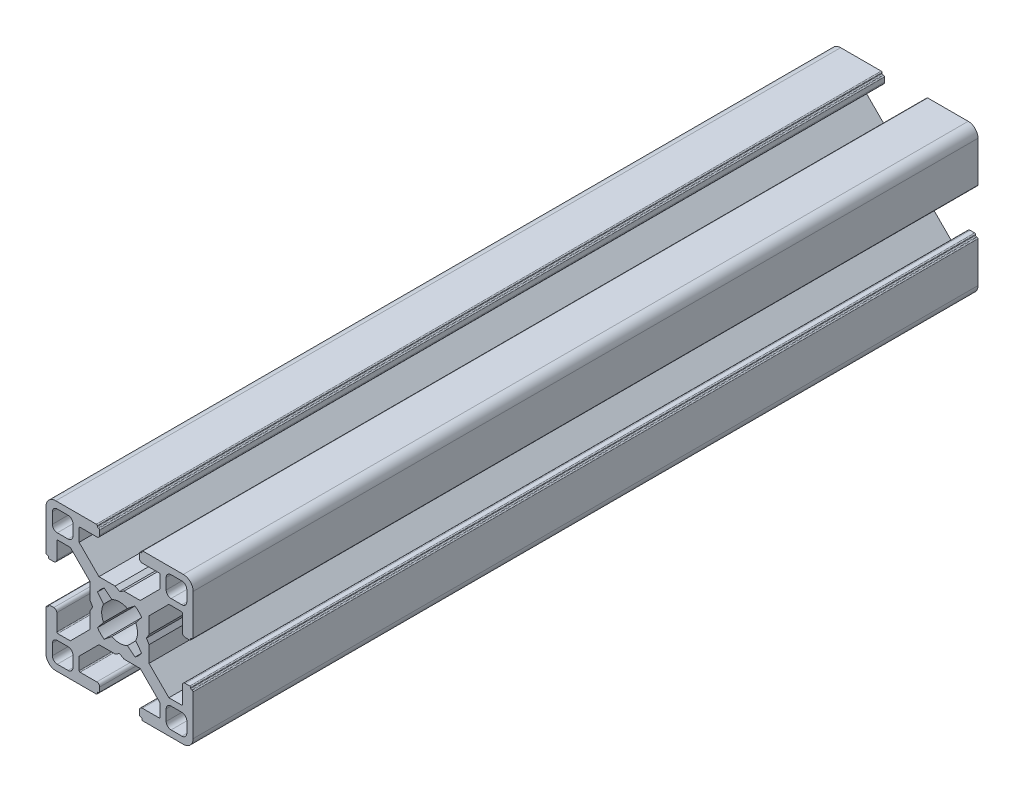
from build123d import *

# Parameters (mm, degrees)
BASE_EXTRUDE_DEPTH = 160


with BuildPart() as part:
    # Sketch1 → Base-Extrude (new body)
    with BuildSketch(Plane.XY):
        with BuildLine():
            Line((6.00446543, 0.899999619), (5.484852164, 0))
            Line((5.484852164, 0), (6.00446543, -0.899999619))
            Line((6.00446543, -0.899999619), (6.00446543, -4.204465866))
            Line((6.00446543, -4.204465866), (10.049999564, -8.25))
            Line((10.049999564, -8.25), (12.59999928, -8.25))
            ThreePointArc((12.59999928, -8.25), (12.741420837, -8.191421273), (12.799999564, -8.049999716))
            Line((12.799999564, -8.049999716), (12.799999564, -4.649999613))
            ThreePointArc((12.799999564, -4.649999613), (12.975735606, -4.225735278), (13.39999994, -4.049999237))
            Line((13.39999994, -4.049999237), (14.300000043, -4.049999237))
            ThreePointArc((14.300000043, -4.049999237), (14.4414216, -4.108577964), (14.500000327, -4.249999521))
            Line((14.500000327, -4.249999521), (14.500000327, -4.349998953))
            ThreePointArc((14.500000327, -4.349998953), (14.558579054, -4.49142051), (14.700000611, -4.549999237))
            Line((14.700000611, -4.549999237), (14.799999716, -4.549999237))
            ThreePointArc((14.799999716, -4.549999237), (14.941421273, -4.608577964), (15, -4.749999521))
            Line((15, -4.749999521), (15, -13.000000346))
            ThreePointArc((15, -13.000000346), (14.414213664, -14.414213664), (13.000000346, -15))
            Line((13.000000346, -15), (4.749999945, -15))
            ThreePointArc((4.749999945, -15), (4.60857832, -14.941421245), (4.549999564, -14.799999619))
            Line((4.549999564, -14.799999619), (4.549999564, -14.69999942))
            ThreePointArc((4.549999564, -14.69999942), (4.49142109, -14.558578474), (4.350000144, -14.5))
            Line((4.350000144, -14.5), (4.250000374, -14.5))
            ThreePointArc((4.250000374, -14.5), (4.108578753, -14.441421247), (4.05, -14.299999626))
            Line((4.05, -14.299999626), (4.05, -13.399999434))
            ThreePointArc((4.05, -13.399999434), (4.225735989, -12.975735226), (4.650000197, -12.799999237))
            Line((4.650000197, -12.799999237), (8.049999924, -12.799999237))
            ThreePointArc((8.049999924, -12.799999237), (8.191421565, -12.741420475), (8.250000327, -12.599998834))
            Line((8.250000327, -12.599998834), (8.250000327, -10.049999237))
            Line((8.250000327, -10.049999237), (4.204466193, -6))
            Line((4.204466193, -6), (0.899999946, -6))
            Line((0.899999946, -6), (0, -5.484851837))
            Line((0, -5.484851837), (-0.899999946, -6))
            Line((-0.899999946, -6), (-4.204466193, -6))
            Line((-4.204466193, -6), (-8.250000327, -10.049999237))
            Line((-8.250000327, -10.049999237), (-8.250000327, -12.599998834))
            ThreePointArc((-8.250000327, -12.599998834), (-8.191421565, -12.741420475), (-8.049999924, -12.799999237))
            Line((-8.049999924, -12.799999237), (-4.650000197, -12.799999237))
            ThreePointArc((-4.650000197, -12.799999237), (-4.225735989, -12.975735226), (-4.05, -13.399999434))
            Line((-4.05, -13.399999434), (-4.05, -14.299999626))
            ThreePointArc((-4.05, -14.299999626), (-4.108578753, -14.441421247), (-4.250000374, -14.5))
            Line((-4.250000374, -14.5), (-4.350000144, -14.5))
            ThreePointArc((-4.350000144, -14.5), (-4.49142109, -14.558578474), (-4.549999564, -14.69999942))
            Line((-4.549999564, -14.69999942), (-4.549999564, -14.799999619))
            ThreePointArc((-4.549999564, -14.799999619), (-4.60857832, -14.941421245), (-4.749999945, -15))
            Line((-4.749999945, -15), (-13.000000346, -15))
            ThreePointArc((-13.000000346, -15), (-14.414213664, -14.414213664), (-15, -13.000000346))
            Line((-15, -13.000000346), (-15, -4.749999521))
            ThreePointArc((-15, -4.749999521), (-14.941421273, -4.608577964), (-14.799999716, -4.549999237))
            Line((-14.799999716, -4.549999237), (-14.700000611, -4.549999237))
            ThreePointArc((-14.700000611, -4.549999237), (-14.558579054, -4.49142051), (-14.500000327, -4.349998953))
            Line((-14.500000327, -4.349998953), (-14.500000327, -4.249999521))
            ThreePointArc((-14.500000327, -4.249999521), (-14.4414216, -4.108577964), (-14.300000043, -4.049999237))
            Line((-14.300000043, -4.049999237), (-13.39999994, -4.049999237))
            ThreePointArc((-13.39999994, -4.049999237), (-12.975735606, -4.225735278), (-12.799999564, -4.649999613))
            Line((-12.799999564, -4.649999613), (-12.799999564, -8.049999716))
            ThreePointArc((-12.799999564, -8.049999716), (-12.741420837, -8.191421273), (-12.59999928, -8.25))
            Line((-12.59999928, -8.25), (-10.049999564, -8.25))
            Line((-10.049999564, -8.25), (-6.00446543, -4.204465866))
            Line((-6.00446543, -4.204465866), (-6.00446543, -0.899999619))
            Line((-6.00446543, -0.899999619), (-5.484852164, 0))
            Line((-5.484852164, 0), (-6.00446543, 0.899999619))
            Line((-6.00446543, 0.899999619), (-6.00446543, 4.204465866))
            Line((-6.00446543, 4.204465866), (-10.049999564, 8.25))
            Line((-10.049999564, 8.25), (-12.59999928, 8.25))
            ThreePointArc((-12.59999928, 8.25), (-12.741420837, 8.191421273), (-12.799999564, 8.049999716))
            Line((-12.799999564, 8.049999716), (-12.799999564, 4.649999613))
            ThreePointArc((-12.799999564, 4.649999613), (-12.975735606, 4.225735278), (-13.39999994, 4.049999237))
            Line((-13.39999994, 4.049999237), (-14.300000043, 4.049999237))
            ThreePointArc((-14.300000043, 4.049999237), (-14.4414216, 4.108577964), (-14.500000327, 4.249999521))
            Line((-14.500000327, 4.249999521), (-14.500000327, 4.349998953))
            ThreePointArc((-14.500000327, 4.349998953), (-14.558579054, 4.49142051), (-14.700000611, 4.549999237))
            Line((-14.700000611, 4.549999237), (-14.799999716, 4.549999237))
            ThreePointArc((-14.799999716, 4.549999237), (-14.941421273, 4.608577964), (-15, 4.749999521))
            Line((-15, 4.749999521), (-15, 13.000000346))
            ThreePointArc((-15, 13.000000346), (-14.414213664, 14.414213664), (-13.000000346, 15))
            Line((-13.000000346, 15), (-4.749999945, 15))
            ThreePointArc((-4.749999945, 15), (-4.60857832, 14.941421245), (-4.549999564, 14.799999619))
            Line((-4.549999564, 14.799999619), (-4.549999564, 14.69999942))
            ThreePointArc((-4.549999564, 14.69999942), (-4.49142109, 14.558578474), (-4.350000144, 14.5))
            Line((-4.350000144, 14.5), (-4.250000374, 14.5))
            ThreePointArc((-4.250000374, 14.5), (-4.108578753, 14.441421247), (-4.05, 14.299999626))
            Line((-4.05, 14.299999626), (-4.05, 13.399999434))
            ThreePointArc((-4.05, 13.399999434), (-4.225735989, 12.975735226), (-4.650000197, 12.799999237))
            Line((-4.650000197, 12.799999237), (-8.049999924, 12.799999237))
            ThreePointArc((-8.049999924, 12.799999237), (-8.191421565, 12.741420475), (-8.250000327, 12.599998834))
            Line((-8.250000327, 12.599998834), (-8.250000327, 10.049999237))
            Line((-8.250000327, 10.049999237), (-4.204466193, 6))
            Line((-4.204466193, 6), (-0.899999946, 6))
            Line((-0.899999946, 6), (0, 5.484851837))
            Line((0, 5.484851837), (0.899999946, 6))
            Line((0.899999946, 6), (4.204466193, 6))
            Line((4.204466193, 6), (8.250000327, 10.049999237))
            Line((8.250000327, 10.049999237), (8.250000327, 12.599998834))
            ThreePointArc((8.250000327, 12.599998834), (8.191421565, 12.741420475), (8.049999924, 12.799999237))
            Line((8.049999924, 12.799999237), (4.650000197, 12.799999237))
            ThreePointArc((4.650000197, 12.799999237), (4.225735989, 12.975735226), (4.05, 13.399999434))
            Line((4.05, 13.399999434), (4.05, 14.299999626))
            ThreePointArc((4.05, 14.299999626), (4.108578753, 14.441421247), (4.250000374, 14.5))
            Line((4.250000374, 14.5), (4.350000144, 14.5))
            ThreePointArc((4.350000144, 14.5), (4.49142109, 14.558578474), (4.549999564, 14.69999942))
            Line((4.549999564, 14.69999942), (4.549999564, 14.799999619))
            ThreePointArc((4.549999564, 14.799999619), (4.60857832, 14.941421245), (4.749999945, 15))
            Line((4.749999945, 15), (13.000000346, 15))
            ThreePointArc((13.000000346, 15), (14.414213664, 14.414213664), (15, 13.000000346))
            Line((15, 13.000000346), (15, 4.749999521))
            ThreePointArc((15, 4.749999521), (14.941421273, 4.608577964), (14.799999716, 4.549999237))
            Line((14.799999716, 4.549999237), (14.700000611, 4.549999237))
            ThreePointArc((14.700000611, 4.549999237), (14.558579054, 4.49142051), (14.500000327, 4.349998953))
            Line((14.500000327, 4.349998953), (14.500000327, 4.249999521))
            ThreePointArc((14.500000327, 4.249999521), (14.4414216, 4.108577964), (14.300000043, 4.049999237))
            Line((14.300000043, 4.049999237), (13.39999994, 4.049999237))
            ThreePointArc((13.39999994, 4.049999237), (12.975735606, 4.225735278), (12.799999564, 4.649999613))
            Line((12.799999564, 4.649999613), (12.799999564, 8.049999716))
            ThreePointArc((12.799999564, 8.049999716), (12.741420837, 8.191421273), (12.59999928, 8.25))
            Line((12.59999928, 8.25), (10.049999564, 8.25))
            Line((10.049999564, 8.25), (6.00446543, 4.204465866))
            Line((6.00446543, 4.204465866), (6.00446543, 0.899999619))
        make_face()
        with BuildLine():
            Line((13.70000109, 12.700000408), (13.70000109, 10.499999626))
            ThreePointArc((13.70000109, 10.499999626), (13.407107874, 9.792892851), (12.7000011, 9.499999635))
            Line((12.7000011, 9.499999635), (10.500000318, 9.499999635))
            ThreePointArc((10.500000318, 9.499999635), (9.792893543, 9.792892851), (9.500000327, 10.499999626))
            Line((9.500000327, 10.499999626), (9.500000327, 12.700000408))
            ThreePointArc((9.500000327, 12.700000408), (9.792893543, 13.407107182), (10.500000318, 13.700000398))
            Line((10.500000318, 13.700000398), (12.7000011, 13.700000398))
            ThreePointArc((12.7000011, 13.700000398), (13.407107874, 13.407107182), (13.70000109, 12.700000408))
        make_face(mode=Mode.SUBTRACT)
        with BuildLine():
            Line((3.135929412, 4.518400903), (1.600129524, 3.280561767))
            ThreePointArc((1.600129524, 3.280561767), (0, 3.65), (-1.600129524, 3.280561767))
            Line((-1.600129524, 3.280561767), (-3.135929412, 4.518400903))
            ThreePointArc((-3.135929412, 4.518400903), (-3.881002259, 3.897155561), (-4.505336892, 3.154669473))
            Line((-4.505336892, 3.154669473), (-3.280561732, 1.600129597))
            ThreePointArc((-3.280561732, 1.600129597), (-3.65, 0), (-3.280561732, -1.600129597))
            Line((-3.280561732, -1.600129597), (-4.505336892, -3.154669473))
            ThreePointArc((-4.505336892, -3.154669473), (-3.881002259, -3.897155561), (-3.135929412, -4.518400903))
            Line((-3.135929412, -4.518400903), (-1.600129524, -3.280561767))
            ThreePointArc((-1.600129524, -3.280561767), (0, -3.65), (1.600129524, -3.280561767))
            Line((1.600129524, -3.280561767), (3.135929412, -4.518400903))
            ThreePointArc((3.135929412, -4.518400903), (3.881002259, -3.897155561), (4.505336892, -3.154669473))
            Line((4.505336892, -3.154669473), (3.280561732, -1.600129597))
            ThreePointArc((3.280561732, -1.600129597), (3.65, 0), (3.280561732, 1.600129597))
            Line((3.280561732, 1.600129597), (4.505336892, 3.154669473))
            ThreePointArc((4.505336892, 3.154669473), (3.881002259, 3.897155561), (3.135929412, 4.518400903))
        make_face(mode=Mode.SUBTRACT)
        with BuildLine():
            Line((-13.70000109, -12.700000408), (-13.70000109, -10.499999626))
            ThreePointArc((-13.70000109, -10.499999626), (-13.407107874, -9.792892851), (-12.7000011, -9.499999635))
            Line((-12.7000011, -9.499999635), (-10.500000318, -9.499999635))
            ThreePointArc((-10.500000318, -9.499999635), (-9.792893543, -9.792892851), (-9.500000327, -10.499999626))
            Line((-9.500000327, -10.499999626), (-9.500000327, -12.700000408))
            ThreePointArc((-9.500000327, -12.700000408), (-9.792893543, -13.407107182), (-10.500000318, -13.700000398))
            Line((-10.500000318, -13.700000398), (-12.7000011, -13.700000398))
            ThreePointArc((-12.7000011, -13.700000398), (-13.407107874, -13.407107182), (-13.70000109, -12.700000408))
        make_face(mode=Mode.SUBTRACT)
        with BuildLine():
            Line((10.500000318, -13.700000398), (12.7000011, -13.700000398))
            ThreePointArc((12.7000011, -13.700000398), (13.407107874, -13.407107182), (13.70000109, -12.700000408))
            Line((13.70000109, -12.700000408), (13.70000109, -10.499999626))
            ThreePointArc((13.70000109, -10.499999626), (13.407107874, -9.792892851), (12.7000011, -9.499999635))
            Line((12.7000011, -9.499999635), (10.500000318, -9.499999635))
            ThreePointArc((10.500000318, -9.499999635), (9.792893543, -9.792892851), (9.500000327, -10.499999626))
            Line((9.500000327, -10.499999626), (9.500000327, -12.700000408))
            ThreePointArc((9.500000327, -12.700000408), (9.792893543, -13.407107182), (10.500000318, -13.700000398))
        make_face(mode=Mode.SUBTRACT)
        with BuildLine():
            Line((-10.500000318, 13.700000398), (-12.7000011, 13.700000398))
            ThreePointArc((-12.7000011, 13.700000398), (-13.407107874, 13.407107182), (-13.70000109, 12.700000408))
            Line((-13.70000109, 12.700000408), (-13.70000109, 10.499999626))
            ThreePointArc((-13.70000109, 10.499999626), (-13.407107874, 9.792892851), (-12.7000011, 9.499999635))
            Line((-12.7000011, 9.499999635), (-10.500000318, 9.499999635))
            ThreePointArc((-10.500000318, 9.499999635), (-9.792893543, 9.792892851), (-9.500000327, 10.499999626))
            Line((-9.500000327, 10.499999626), (-9.500000327, 12.700000408))
            ThreePointArc((-9.500000327, 12.700000408), (-9.792893543, 13.407107182), (-10.500000318, 13.700000398))
        make_face(mode=Mode.SUBTRACT)
    extrude(amount=-BASE_EXTRUDE_DEPTH)


solid = part.part
